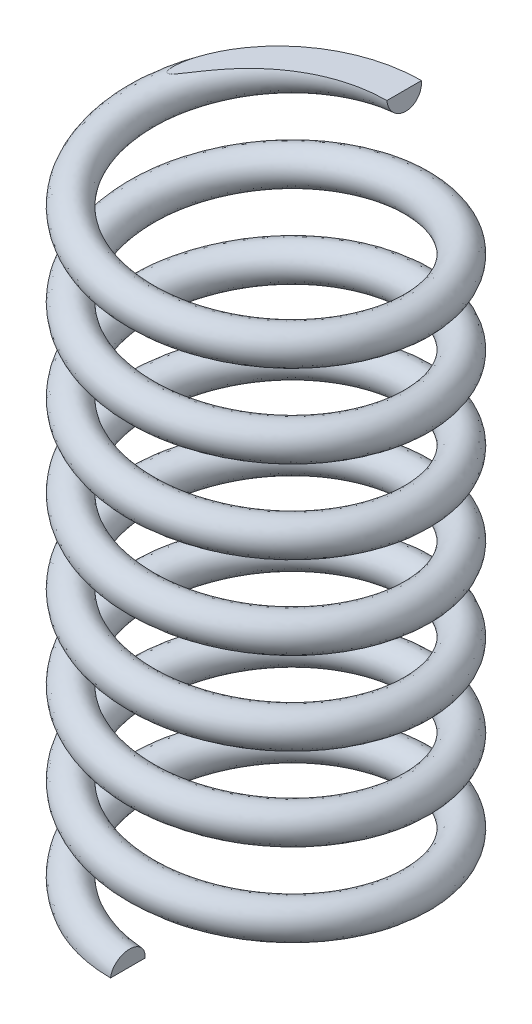
from build123d import *

# Parameters (mm, degrees)
COIL_WIRE_SWEEP_PITCH        = 12
COIL_WIRE_SWEEP_HEIGHT       = 90
COIL_WIRE_SWEEP_RADIUS       = 20
COIL_WIRE_SWEEP_PROFILE_R    = 2.5
SKETCH8_R                    = 30
BOTTOM_GROUND_SEAT_CUT_DEPTH = 98.809287702
SKETCH9_R                    = 30
TOP_GROUND_SEAT_CUT_DEPTH    = 98.809287702


with BuildPart() as part:
    # Coil Wire Sweep: sweep along a helix
    with BuildLine() as coil_wire_sweep_path:
        Helix(COIL_WIRE_SWEEP_PITCH, COIL_WIRE_SWEEP_HEIGHT, COIL_WIRE_SWEEP_RADIUS, center=(0, 0, 0), direction=(0, 1, 0), lefthand=True)
    # Coil Wire Sweep profile (on start of the path) → Coil Wire Sweep (sweep)
    with BuildSketch(Plane(origin=(0, 0, 20), x_dir=(-0.09506052544078494, -0.9954714945707496, 0), z_dir=(-0.9954714945707496, 0.09506052544078494, 2.705319257574724e-13))):
        Circle(COIL_WIRE_SWEEP_PROFILE_R)
    sweep(path=coil_wire_sweep_path.line, is_frenet=True)

    # Sketch8 → Bottom Ground Seat Cut (cut, through all)
    with BuildSketch(Plane(origin=(0, 0, 0), x_dir=(1, 0, 0), z_dir=(0, 1, 0))):
        Circle(SKETCH8_R)
    extrude(amount=-BOTTOM_GROUND_SEAT_CUT_DEPTH, mode=Mode.SUBTRACT)

    # Sketch9 → Top Ground Seat Cut (cut, through all)
    with BuildSketch(Plane(origin=(0, 90, 0), x_dir=(1, 0, 0), z_dir=(0, 1, 0))):
        Circle(SKETCH9_R)
    extrude(amount=TOP_GROUND_SEAT_CUT_DEPTH, mode=Mode.SUBTRACT)


solid = part.part
